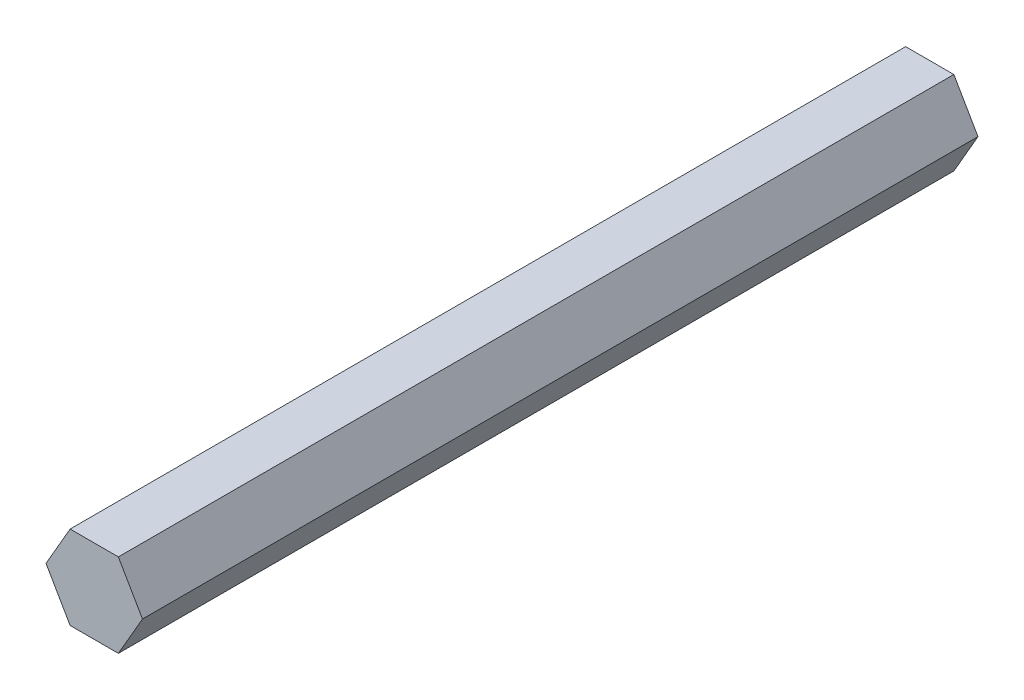
from build123d import *

# Parameters (mm, degrees)
BOSS_EXTRUDE1_DEPTH = 127


with BuildPart() as part:
    # Sketch1 → Boss-Extrude1 (new body)
    with BuildSketch(Plane.XY):
        Polygon((7.332348419, 0), (3.666174209, 6.35), (-3.666174209, 6.35), (-7.332348419, 0), (-3.666174209, -6.35), (3.666174209, -6.35), align=None)
    extrude(amount=BOSS_EXTRUDE1_DEPTH)


solid = part.part
